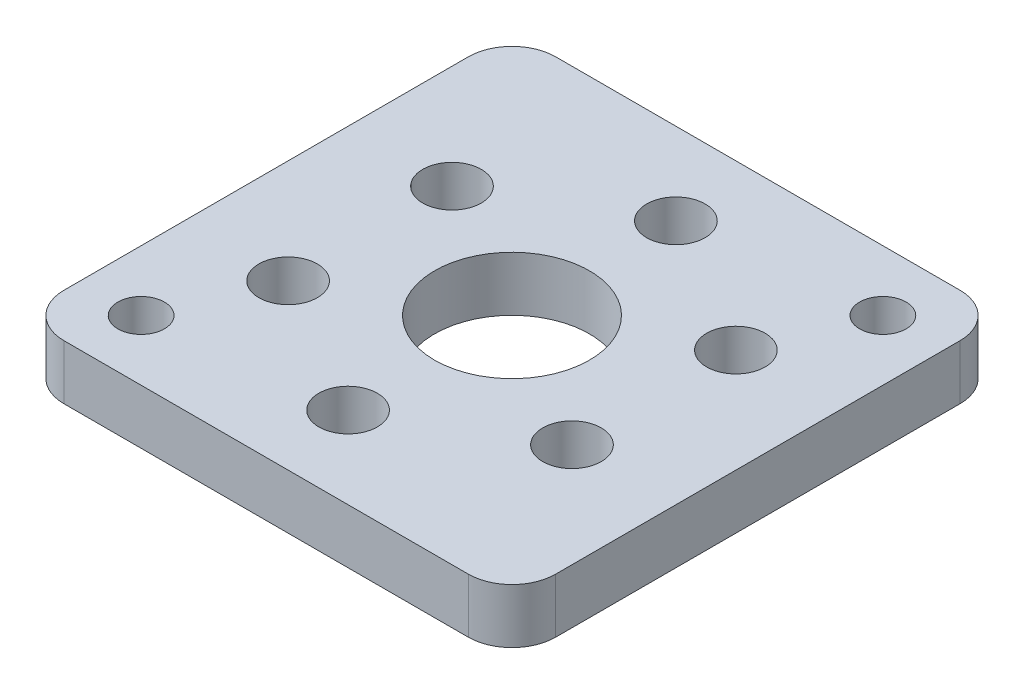
from build123d import *

# Parameters (mm, degrees)
SKETCH1_W             = 28.575
SKETCH1_H             = 28.575
BOSS_EXTRUDE1_DEPTH   = 3.175
M3_CLEARANCE_HOLE1_D  = 3.4
SKETCH2_R             = 4.5
CUT_EXTRUDE2_DEPTH    = 21.453506729
CIRPATTERN1_COUNT     = 6
F_6_32_TAPPED_HOLE1_D = 2.7051
FILLET1_R             = 2.54


with BuildPart() as part:
    # Sketch1 → Boss-Extrude1 (new body)
    with BuildSketch(Plane(origin=(0, 0, 0), x_dir=(1, 0, 0), z_dir=(0, 1, 0))):
        Rectangle(SKETCH1_W, SKETCH1_H)
    extrude(amount=BOSS_EXTRUDE1_DEPTH)

    # M3 Clearance Hole1 (through all)
    with Locations(Plane(origin=(0, 3.175, 0), x_dir=(1, 0, 0), z_dir=(0, 1, 0))):
        with Locations((0, 9.525)):
            m3_clearance_hole1 = Hole(M3_CLEARANCE_HOLE1_D / 2)

    # Sketch2 → Cut-Extrude2 (cut, through all)
    with BuildSketch(Plane(origin=(0, 3.175, 0), x_dir=(1, 0, 0), z_dir=(0, 1, 0))):
        with Locations(Location((0, 0, 0), (0, 0, 270))):
            Circle(SKETCH2_R)
    extrude(amount=-CUT_EXTRUDE2_DEPTH, mode=Mode.SUBTRACT)

    # CirPattern1: M3 Clearance Hole1 ×6 about axis
    cirpattern1_axis = Axis((0, 0, 0), (0, 1, 0))
    for i in range(1, CIRPATTERN1_COUNT):
        add(m3_clearance_hole1.rotate(cirpattern1_axis, i * 360 / CIRPATTERN1_COUNT), mode=Mode.SUBTRACT)

    # #6-32 Tapped Hole1 (through all)
    with Locations(Plane(origin=(0, 3.175, 0), x_dir=(1, 0, 0), z_dir=(0, 1, 0))):
        with Locations((10.776307345, 10.776307345), (-10.776307345, -10.776307345)):
            Hole(F_6_32_TAPPED_HOLE1_D / 2)

    # Fillet1
    fillet1_edges = [part.edges().sort_by_distance(p)[0] for p in [
        (14.2875, 1.5875, 14.2875),
        (-14.2875, 1.5875, 14.2875),
        (-14.2875, 1.5875, -14.2875),
        (14.2875, 1.5875, -14.2875),
    ]]
    fillet(fillet1_edges, radius=FILLET1_R)


solid = part.part
